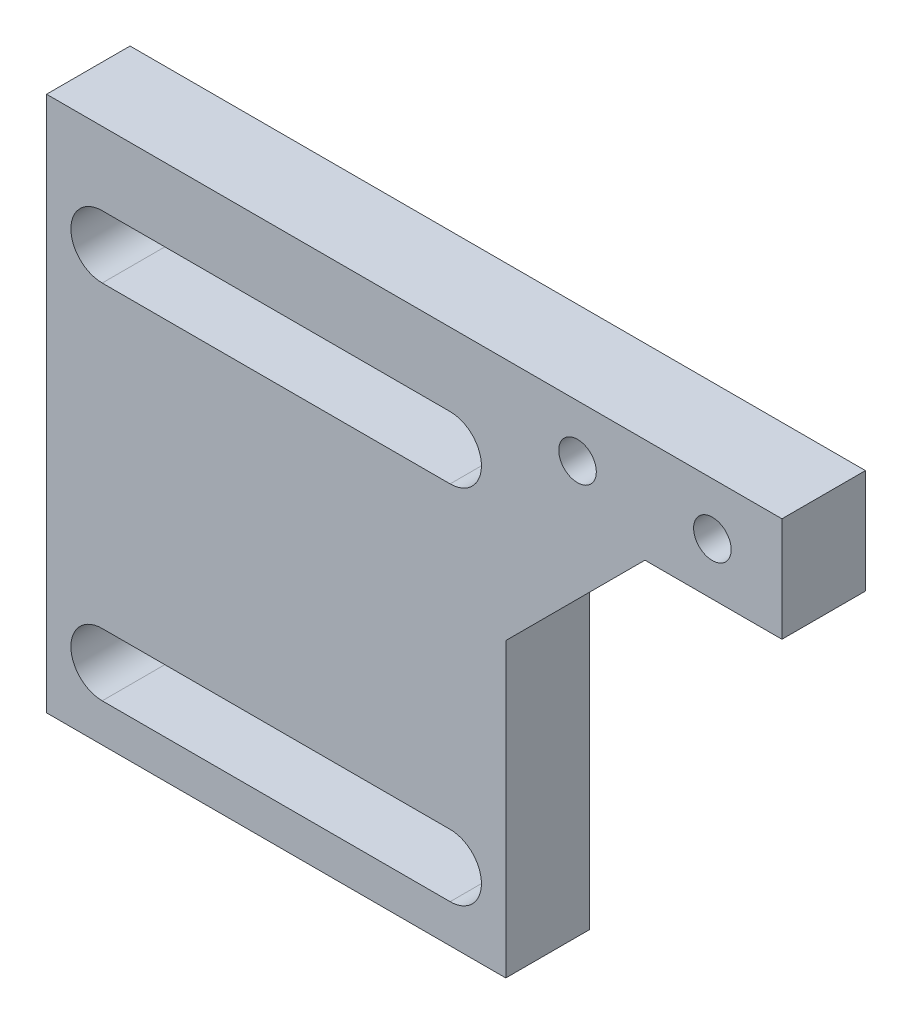
from build123d import *

# Parameters (mm, degrees)
SKETCH7_R           = 1.35
BOSS_EXTRUDE4_DEPTH = 6
CHAMFER1_SIZE       = 10


with BuildPart() as part:
    # Sketch7 → Boss-Extrude4 (new body)
    with BuildSketch(Plane.XY):
        Polygon((-52.845, 0), (0, 0), (0, -7.5), (-19.845, -7.5), (-19.845, -38.5), (-52.845, -38.5), align=None)
        with Locations((-14.69, -3.75)):
            Circle(SKETCH7_R, mode=Mode.SUBTRACT)
        with Locations((-5, -3.75)):
            Circle(SKETCH7_R, mode=Mode.SUBTRACT)
        with BuildLine():
            Line((-48.845, -5.25), (-23.845, -5.25))
            ThreePointArc((-23.845, -5.25), (-21.595, -7.5), (-23.845, -9.75))
            Line((-23.845, -9.75), (-48.845, -9.75))
            ThreePointArc((-48.845, -9.75), (-51.095, -7.5), (-48.845, -5.25))
        make_face(mode=Mode.SUBTRACT)
        with BuildLine():
            Line((-48.845, -31.25), (-23.845, -31.25))
            ThreePointArc((-23.845, -31.25), (-21.595, -33.5), (-23.845, -35.75))
            Line((-23.845, -35.75), (-48.845, -35.75))
            ThreePointArc((-48.845, -35.75), (-51.095, -33.5), (-48.845, -31.25))
        make_face(mode=Mode.SUBTRACT)
    extrude(amount=BOSS_EXTRUDE4_DEPTH)

    # Chamfer1
    chamfer1_edges = [part.edges().sort_by_distance(p)[0] for p in [
        (-19.845, -7.5, 3),
    ]]
    chamfer(chamfer1_edges, length=CHAMFER1_SIZE)


solid = part.part
